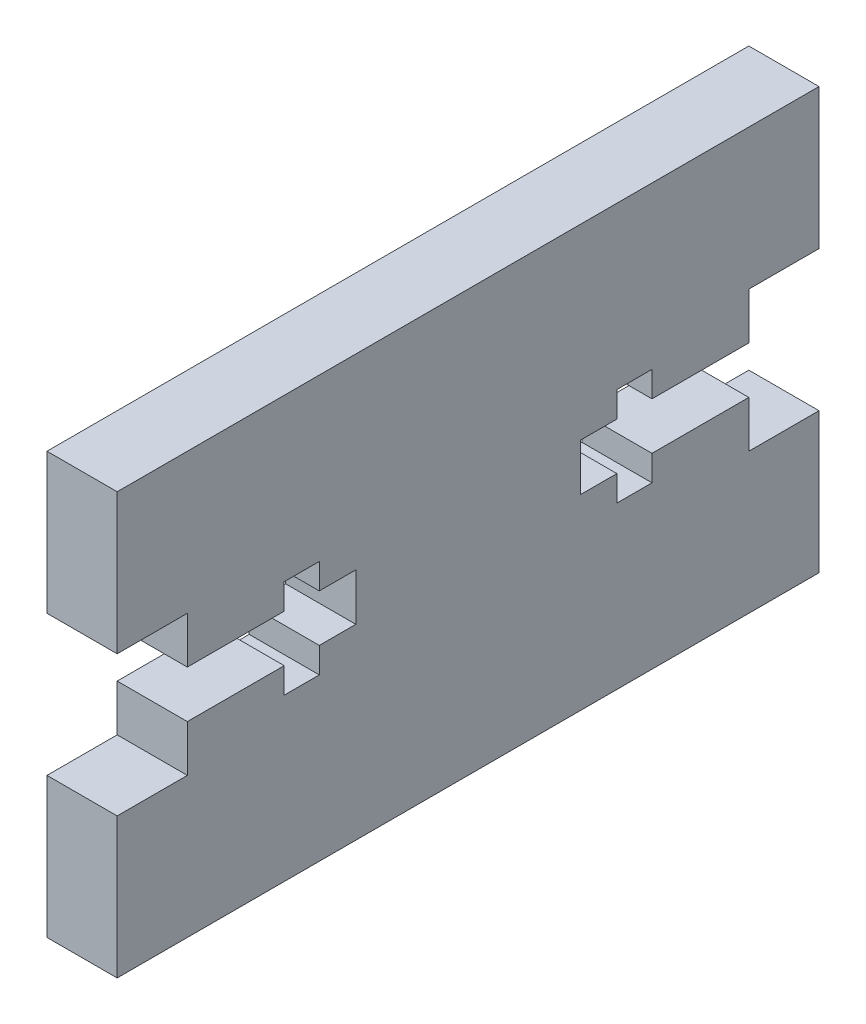
from build123d import *

# Parameters (mm, degrees)
SKETCH1_W           = 6.35
SKETCH1_H           = 38.1
BOSS_EXTRUDE1_DEPTH = 50.8
SKETCH2_W           = 6.35
SKETCH2_H           = 12.7
BOSS_EXTRUDE2_DEPTH = 6.35
CUT_EXTRUDE1_DEPTH  = 55.624765446


with BuildPart() as part:
    # Sketch1 → Boss-Extrude1 (new body)
    with BuildSketch(Plane.XY):
        with Locations((-14.605, 0)):
            Rectangle(SKETCH1_W, SKETCH1_H)
    extrude(amount=BOSS_EXTRUDE1_DEPTH)

    # Sketch2 → Boss-Extrude2 (add)
    with BuildSketch(Plane(origin=(0, 0, 0), x_dir=(-1, 0, 0), z_dir=(0, 0, -1))):
        with Locations((14.605, -12.7)):
            Rectangle(SKETCH2_W, SKETCH2_H)
        with Locations((14.605, 12.7)):
            Rectangle(SKETCH2_W, SKETCH2_H)
    boss_extrude2 = extrude(amount=BOSS_EXTRUDE2_DEPTH)

    # Sketch3 → Cut-Extrude1 (cut, through all)
    with BuildSketch(Plane.ZY.offset(17.78)):
        Polygon((0, 2.1336), (0, -2.1336), (8.763, -2.1336), (8.763, -4.445), (11.938, -4.445), (11.938, -2.1336), (15.24, -2.1336), (15.24, 2.1336), (11.938, 2.1336), (11.938, 4.445), (8.763, 4.445), (8.763, 2.1336), align=None)
    cut_extrude1 = extrude(amount=-CUT_EXTRUDE1_DEPTH, mode=Mode.SUBTRACT)

    # Mirror1: Boss-Extrude2, Cut-Extrude1 across plane
    add(boss_extrude2.mirror(Plane.XY.offset(25.4)))
    add(cut_extrude1.mirror(Plane.XY.offset(25.4)), mode=Mode.SUBTRACT)


solid = part.part
